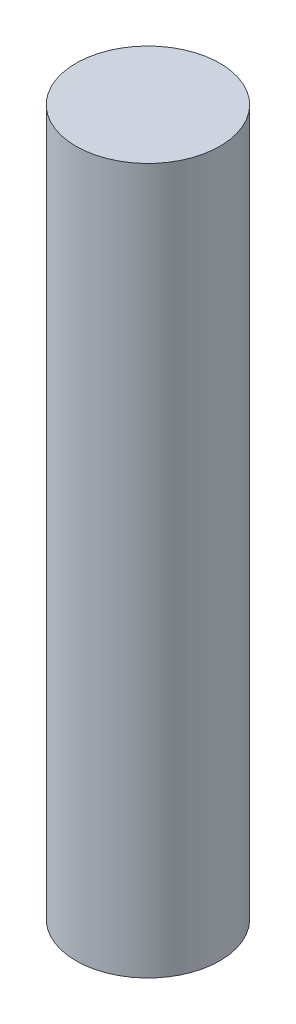
from build123d import *

# Parameters (mm, degrees)
SKETCH1_R           = 2.55
BOSS_EXTRUDE1_DEPTH = 25


with BuildPart() as part:
    # Sketch1 → Boss-Extrude1 (new body)
    with BuildSketch(Plane(origin=(0, 0, 0), x_dir=(1, 0, 0), z_dir=(0, 1, 0))):
        with Locations(Location((0, 0, 0), (0, 0, 270))):
            Circle(SKETCH1_R)
    extrude(amount=BOSS_EXTRUDE1_DEPTH)


solid = part.part
